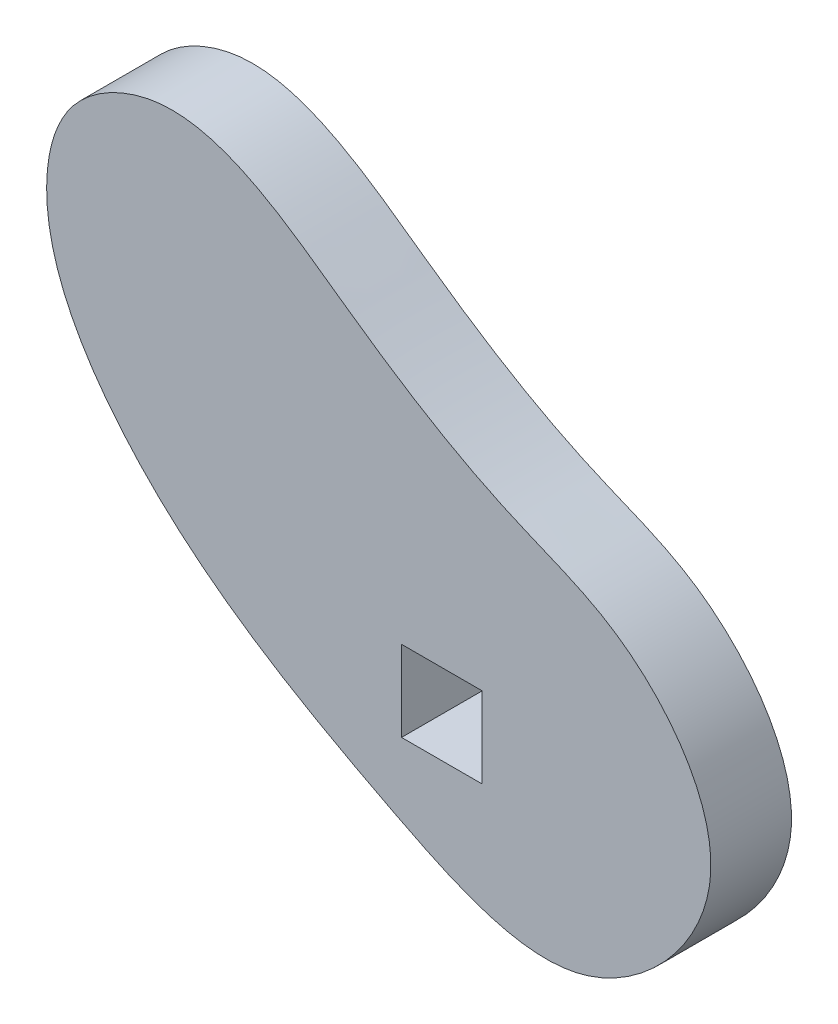
from build123d import *

# Parameters (mm, degrees)
SKETCH1_W           = 1.524
SKETCH1_H           = 1.524
BOSS_EXTRUDE1_DEPTH = 1.524


with BuildPart() as part:
    # Sketch1 → Boss-Extrude1 (new body)
    with BuildSketch(Plane.XY):
        with BuildLine():
            add(Edge.make_bspline(
                [(0.660908285, 46.785558308), (-1.346534542, 47.816784902), (-4.038356636, 49.38924119), (-6.155392056, 52.897901142), (-5.723974726, 55.422202791), (-3.100925458, 56.794062303), (-0.236346841, 54.500709799), (2.438244997, 52.847713917), (5.340397971, 51.837363148), (7.641089541, 48.717984147), (4.290092084, 45.005033917), (1.812428684, 46.194020436), (0.660908285, 46.785558308)],
                knots=[0, 0, 0, 0, 0.187161272, 0.282081323, 0.339121723, 0.391249692, 0.510584906, 0.617523685, 0.677210612, 0.782744002, 0.892639521, 1, 1, 1, 1], degree=3))
        make_face()
        with Locations((1.55818596, 48.853678484)):
            Rectangle(SKETCH1_W, SKETCH1_H, mode=Mode.SUBTRACT)
    extrude(amount=BOSS_EXTRUDE1_DEPTH)


solid = part.part
